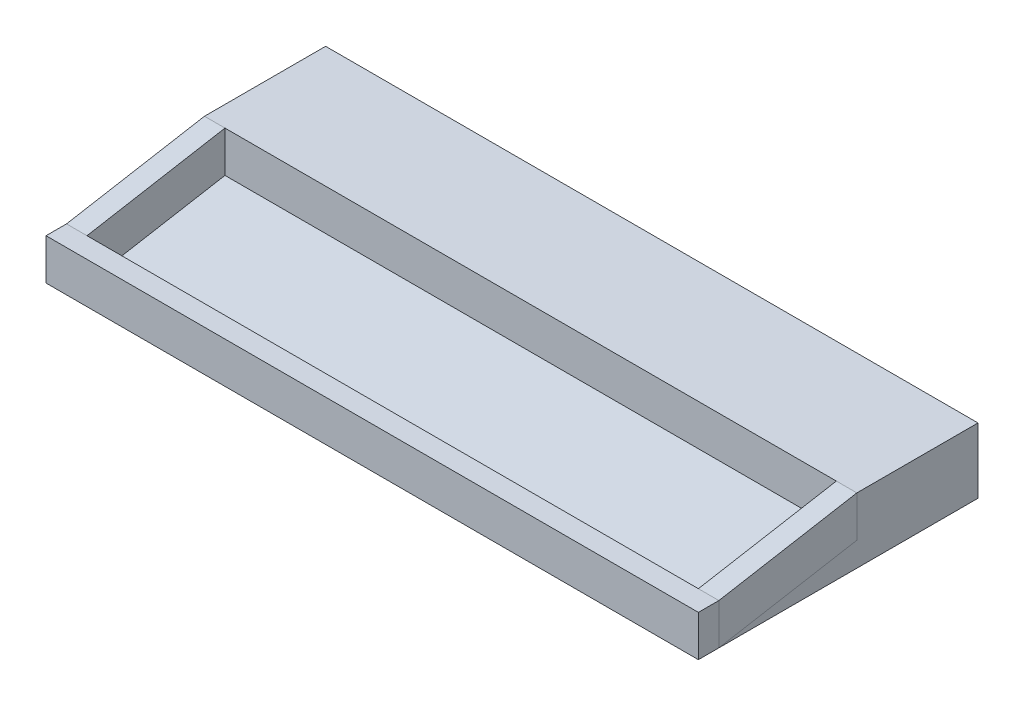
from build123d import *

# Parameters (mm, degrees)
ESQUISSE1_W        = 130
ESQUISSE1_H        = 22
ESQUISSE1_W_2      = 22
BOSS_EXTRU_1_DEPTH = 700
BOSS_EXTRU_5_DEPTH = 22
BOSS_EXTRU_7_DEPTH = 22


with BuildPart() as part:
    # Esquisse1 → Boss.-Extru.1 (new body)
    with BuildSketch(Plane(origin=(0, 0, 0), x_dir=(0, 0, -1), z_dir=(1, 0, 0))):
        with Locations((7.021510311, 14.453362141)):
            Rectangle(ESQUISSE1_W, ESQUISSE1_H)
        Polygon((-57.978489689, 3.453362141), (-57.978489689, -18.546637859), (-57.978489689, -44.546637859), (72.021510311, -44.546637859), (72.021510311, 3.453362141), align=None)
        Polygon((-57.978489689, -44.546637859), (-57.978489689, -18.546637859), (-206.012573602, -44.546637859), align=None)
        with Locations((-217.012573602, -33.546637859)):
            Rectangle(ESQUISSE1_W_2, ESQUISSE1_H)
        with Locations((-217.012573602, -11.546637859)):
            Rectangle(ESQUISSE1_W_2, ESQUISSE1_H)
    extrude(amount=BOSS_EXTRU_1_DEPTH)


with BuildPart() as body_2:
    # Esquisse2 → Boss.-Extru.5 (new body)
    with BuildSketch(Plane(origin=(700, 0, 0), x_dir=(0, 0, -1), z_dir=(1, 0, 0))):
        Polygon((-57.978489689, 25.453362141), (-206.012573602, -0.546637859), (-206.012573602, -44.546637859), (-57.978489689, -18.546637859), align=None)
    extrude(amount=-BOSS_EXTRU_5_DEPTH)


with BuildPart() as body_3:
    # Esquisse3 → Boss.-Extru.7 (new body)
    with BuildSketch(Plane.ZY):
        Polygon((57.978489689, 25.453362141), (206.012573602, -0.546637859), (206.012573602, -44.546637859), (57.978489689, -18.546637859), align=None)
    extrude(amount=-BOSS_EXTRU_7_DEPTH)


solid = Compound([part.part, body_2.part, body_3.part])
